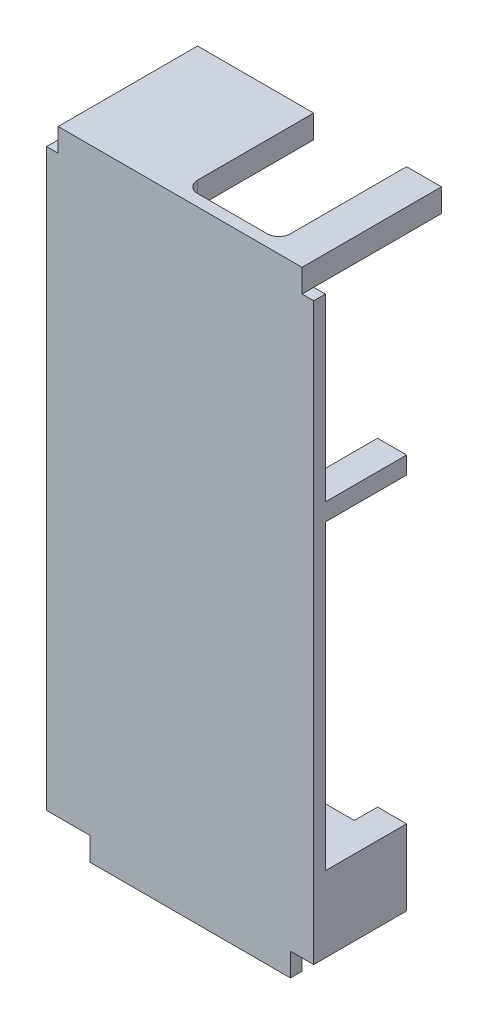
from build123d import *

# Parameters (mm, degrees)
SKETCH1_W           = 21
SKETCH1_H           = 1.747373259
SKETCH1_H_2         = 0.25
SKETCH1_W_2         = 23
SKETCH1_H_3         = 49.505253482
SKETCH1_W_3         = 17.25
BOSS_EXTRUDE1_DEPTH = 1
SKETCH2_W           = 23
SKETCH2_H           = 1.5
SKETCH2_W_2         = 2.5
SKETCH2_W_3         = 8
BOSS_EXTRUDE2_DEPTH = 5
SKETCH3_W           = 2.5
SKETCH3_H           = 1.5
BOSS_EXTRUDE3_DEPTH = 2
SKETCH4_W           = 3
SKETCH4_H           = 1.997373259
SKETCH4_W_2         = 10
BOSS_EXTRUDE4_DEPTH = 11
SKETCH5_W           = 4
SKETCH5_H           = 2.002626741
BOSS_EXTRUDE5_DEPTH = 7
FILLET1_R           = 1


with BuildPart() as part:
    # Sketch1 → Boss-Extrude1 (new body)
    with BuildSketch(Plane.XY):
        with Locations((0, 25.876313371)):
            Rectangle(SKETCH1_W, SKETCH1_H)
        with Locations((0, 24.877626741)):
            Rectangle(SKETCH1_W, SKETCH1_H_2)
        Rectangle(SKETCH1_W_2, SKETCH1_H_3)
        with Locations((0.875, -24.877626741)):
            Rectangle(SKETCH1_W_3, SKETCH1_H_2)
        with Locations((0.875, -25.876313371)):
            Rectangle(SKETCH1_W_3, SKETCH1_H)
    extrude(amount=-BOSS_EXTRUDE1_DEPTH)

    # Sketch2 → Boss-Extrude2 (add)
    with BuildSketch(Plane(origin=(0, 0, -1), x_dir=(-1, 0, 0), z_dir=(0, 0, -1))):
        with Locations((0, -19.002626741)):
            Rectangle(SKETCH2_W, SKETCH2_H)
        with Locations((-10.25, 8.502626741)):
            Rectangle(SKETCH2_W_2, SKETCH2_H)
        with Locations((0, 8.502626741)):
            Rectangle(SKETCH2_W_3, SKETCH2_H)
        with Locations((10.25, 8.502626741)):
            Rectangle(SKETCH2_W_2, SKETCH2_H)
    extrude(amount=BOSS_EXTRUDE2_DEPTH)

    # Sketch3 → Boss-Extrude3 (add)
    with BuildSketch(Plane(origin=(0, 0, -6), x_dir=(-1, 0, 0), z_dir=(0, 0, -1))):
        with Locations((-10.25, 8.502626741)):
            Rectangle(SKETCH3_W, SKETCH3_H)
        with Locations((10.25, 8.502626741)):
            Rectangle(SKETCH3_W, SKETCH3_H)
        with Locations((-10.25, -19.002626741)):
            Rectangle(SKETCH3_W, SKETCH3_H)
        with Locations((10.25, -19.002626741)):
            Rectangle(SKETCH3_W, SKETCH3_H)
    extrude(amount=BOSS_EXTRUDE3_DEPTH)

    # Sketch4 → Boss-Extrude4 (add)
    with BuildSketch(Plane(origin=(0, 0, -1), x_dir=(-1, 0, 0), z_dir=(0, 0, -1))):
        with Locations((-9, 25.751313371)):
            Rectangle(SKETCH4_W, SKETCH4_H)
        with Locations((5.5, 25.751313371)):
            Rectangle(SKETCH4_W_2, SKETCH4_H)
    extrude(amount=BOSS_EXTRUDE4_DEPTH)

    # Sketch5 → Boss-Extrude5 (add)
    with BuildSketch(Plane(origin=(0, 0, -1), x_dir=(-1, 0, 0), z_dir=(0, 0, -1))):
        with Locations((9.5, 23.751313371)):
            Rectangle(SKETCH5_W, SKETCH5_H)
        Polygon((8, -24.752626741), (11.5, -24.752626741), (11.5, -19.752626741), (9, -19.752626741), (9, -21.75), (8, -21.75), align=None)
        Polygon((-11.5, -24.752626741), (-8, -24.752626741), (-8, -21.75), (-9, -21.75), (-9, -19.752626741), (-11.5, -19.752626741), align=None)
    extrude(amount=BOSS_EXTRUDE5_DEPTH)

    # Fillet1
    fillet1_edges = [part.edges().sort_by_distance(p)[0] for p in [
        (7.5, 25.75131337, -1),
        (-0.5, 25.75131337, -1),
        (-4, 8.502626741, -1),
        (4, 8.502626741, -1),
        (9, 8.502626741, -1),
        (-9, 8.502626741, -1),
    ]]
    fillet(fillet1_edges, radius=FILLET1_R)


solid = part.part
